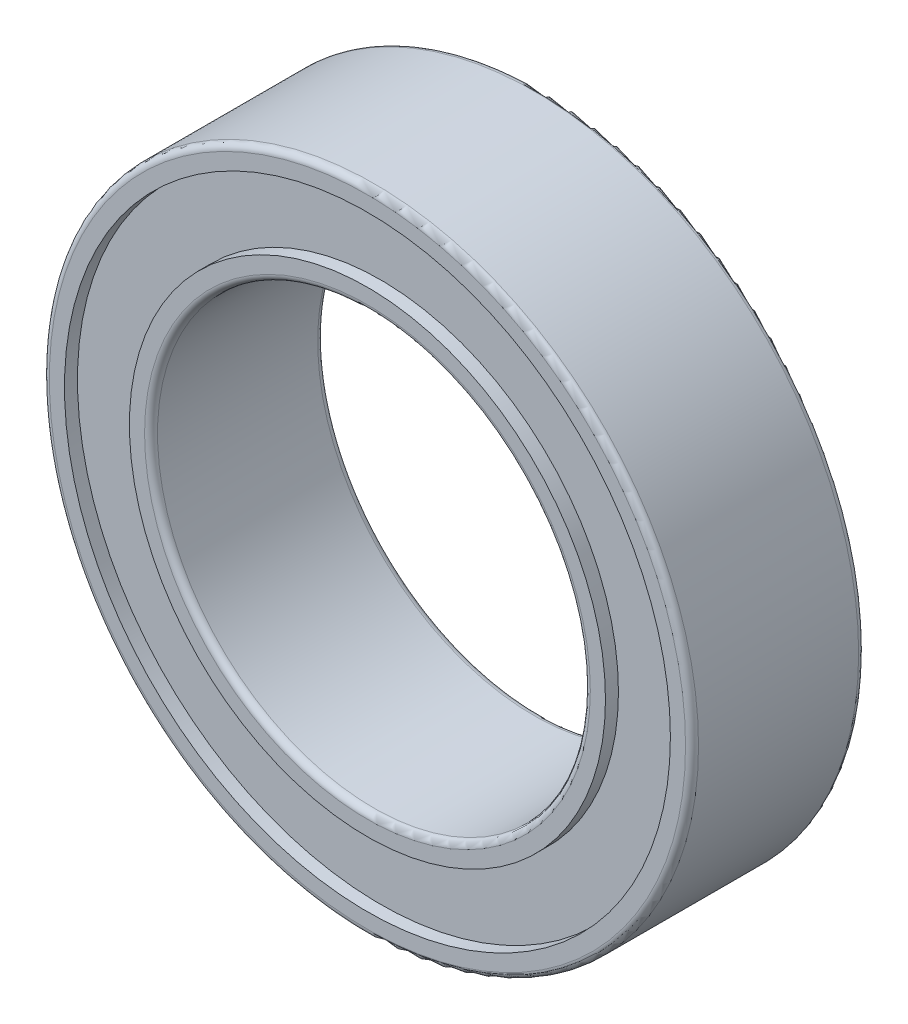
from build123d import *

# Parameters (mm, degrees)
SKETCH1_R           = 7.5
SKETCH1_R_2         = 5
BOSS_EXTRUDE1_DEPTH = 4
SKETCH2_R           = 7
SKETCH2_R_2         = 5.5
CUT_EXTRUDE1_DEPTH  = 0.3
CUT_EXTRUDE2_START  = -3.5
SKETCH2_2_R         = 7
SKETCH2_2_R_2       = 5.5
CUT_EXTRUDE2_DEPTH  = 0.5
FILLET1_R           = 0.15


with BuildPart() as part:
    # Sketch1 → Boss-Extrude1 (new body)
    with BuildSketch(Plane.XY):
        Circle(SKETCH1_R)
        Circle(SKETCH1_R_2, mode=Mode.SUBTRACT)
    extrude(amount=BOSS_EXTRUDE1_DEPTH)

    # Sketch2 → Cut-Extrude1 (cut)
    with BuildSketch(Plane.XY.offset(4)):
        Circle(SKETCH2_R)
        Circle(SKETCH2_R_2, mode=Mode.SUBTRACT)
    extrude(amount=-CUT_EXTRUDE1_DEPTH, mode=Mode.SUBTRACT)

    # Sketch2<2> → Cut-Extrude2 (cut)
    with BuildSketch(Plane.XY.offset(4).offset(CUT_EXTRUDE2_START)):
        Circle(SKETCH2_2_R)
        Circle(SKETCH2_2_R_2, mode=Mode.SUBTRACT)
    extrude(amount=-CUT_EXTRUDE2_DEPTH, mode=Mode.SUBTRACT)

    # Fillet1
    fillet1_edges = [part.edges().sort_by_distance(p)[0] for p in [
        (-7.5, 0, 0),
        (-7.5, 0, 4),
        (-5, 0, 0),
        (-5, 0, 4),
    ]]
    fillet(fillet1_edges, radius=FILLET1_R)


solid = part.part
